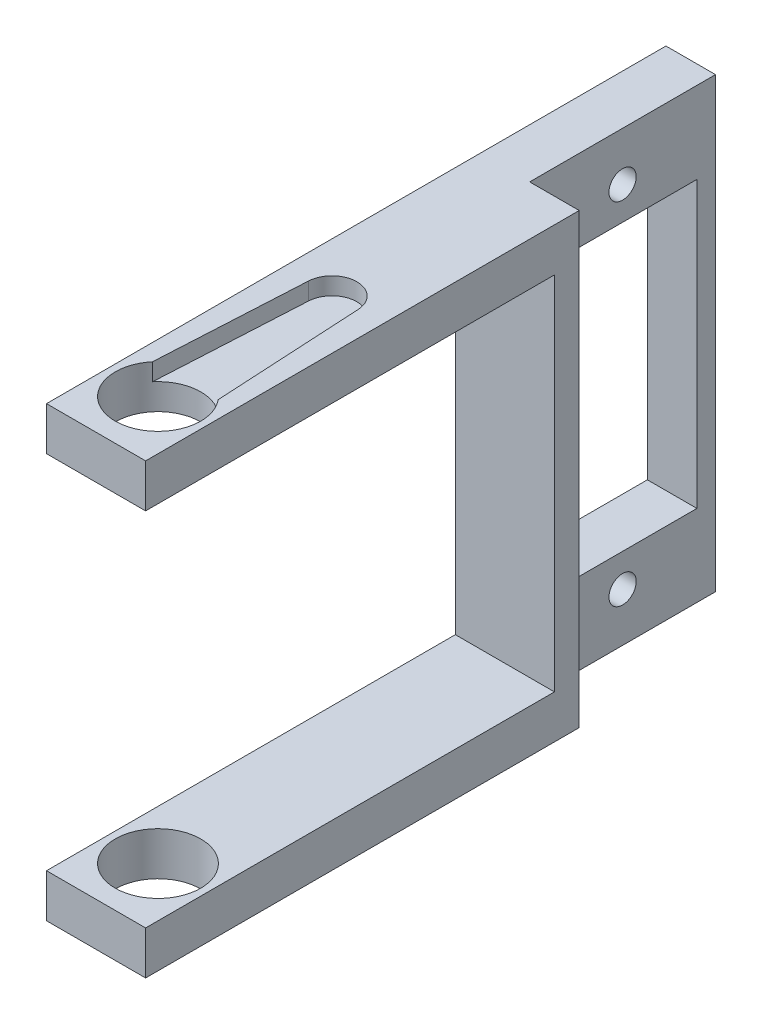
from build123d import *
from build123d.topology import SkipClean

# Parameters (mm, degrees)
SKETCH2_W             = 8
SKETCH2_H             = 3.5
BOSS_EXTRUDE2_DEPTH   = 35
BOSS_EXTRUDE2_2_DEPTH = 35
SKETCH2_3_W           = 8
SKETCH2_3_H           = 29.15
BOSS_EXTRUDE3_DEPTH   = 2
SKETCH7_W             = 4
SKETCH7_H             = 36.15
BOSS_EXTRUDE4_DEPTH   = 15
CUT_EXTRUDE5_REACH    = 51.739
SKETCH8_R             = 1.1
SKETCH8_W             = 12
SKETCH8_H             = 23
CUT_EXTRUDE6_DEPTH    = 1.4
SKETCH10_R            = 3.45
CUT_EXTRUDE7_DEPTH    = 52.060667156


with BuildPart() as part:
    # Sketch2 → Boss-Extrude2 (new body)
    with BuildSketch(Plane.XY):
        with Locations((-4.681545395, -0.713506952)):
            Rectangle(SKETCH2_W, SKETCH2_H)
    extrude(amount=BOSS_EXTRUDE2_DEPTH)

    # Sketch2<3> → Boss-Extrude3 (add)
    with BuildSketch(Plane.XY):
        with Locations((-4.681545395, -17.038506952)):
            Rectangle(SKETCH2_3_W, SKETCH2_3_H)
    extrude(amount=BOSS_EXTRUDE3_DEPTH)



with BuildPart() as body_2:
    # Sketch2 → Boss-Extrude2 2 (new body)
    with BuildSketch(Plane.XY):
        with Locations((-4.681545395, -33.363506952)):
            Rectangle(SKETCH2_W, SKETCH2_H)
    extrude(amount=BOSS_EXTRUDE2_2_DEPTH)


with BuildPart() as part_1:
    add(part.part)

    add(body_2.part)  # Boss-Extrude4 merges body 2
    # Sketch7 → Boss-Extrude4 (add)
    with BuildSketch(Plane(origin=(0, 0, 0), x_dir=(-1, 0, 0), z_dir=(0, 0, -1))):
        with Locations((6.681545395, -17.038506952)):
            Rectangle(SKETCH7_W, SKETCH7_H)
    extrude(amount=BOSS_EXTRUDE4_DEPTH)

    # Sketch8 → Cut-Extrude5 (cut, up to next)
    with BuildSketch(Plane(origin=(-4.681545395, 0, 0), x_dir=(0, 0, -1), z_dir=(1, 0, 0)), mode=Mode.PRIVATE) as cut_extrude5_sk1:
        with Locations((7.5, -2.888506952)):
            Circle(SKETCH8_R)
    cut_extrude5_tool1 = extrude(cut_extrude5_sk1.sketch, amount=-CUT_EXTRUDE5_REACH, mode=Mode.PRIVATE) & part_1.part
    # Sketch8 → Cut-Extrude5 (cut, up to next)
    with BuildSketch(Plane(origin=(-4.681545395, 0, 0), x_dir=(0, 0, -1), z_dir=(1, 0, 0)), mode=Mode.PRIVATE) as cut_extrude5_sk2:
        with Locations((7.5, -31.188506952)):
            Circle(SKETCH8_R)
    cut_extrude5_tool2 = extrude(cut_extrude5_sk2.sketch, amount=-CUT_EXTRUDE5_REACH, mode=Mode.PRIVATE) & part_1.part
    # Sketch8 → Cut-Extrude5 (cut, up to next)
    with BuildSketch(Plane(origin=(-4.681545395, 0, 0), x_dir=(0, 0, -1), z_dir=(1, 0, 0)), mode=Mode.PRIVATE) as cut_extrude5_sk3:
        with Locations((7.5, -17.038506952)):
            Rectangle(SKETCH8_W, SKETCH8_H)
    cut_extrude5_tool3 = extrude(cut_extrude5_sk3.sketch, amount=-CUT_EXTRUDE5_REACH, mode=Mode.PRIVATE) & part_1.part
    add(cut_extrude5_tool1.solids().sort_by_distance((-4.681545, -2.888507, -7.5))[0], mode=Mode.SUBTRACT)
    add(cut_extrude5_tool2.solids().sort_by_distance((-4.681545, -31.188507, -7.5))[0], mode=Mode.SUBTRACT)
    add(cut_extrude5_tool3.solids().sort_by_distance((-4.681545, -17.038507, -7.5))[0], mode=Mode.SUBTRACT)

    # Sketch9 → Cut-Extrude6 (cut)
    with BuildSketch(Plane(origin=(0, 1.036493048, 0), x_dir=(1, 0, 0), z_dir=(0, 1, 0))):
        with BuildLine():
            Line((-2.684524514, -15.840878033), (-2.031545395, -27.790927797))
            ThreePointArc((-2.031545395, -27.790927797), (-4.681545395, -33.45), (-7.331545395, -27.790927797))
            Line((-7.331545395, -27.790927797), (-6.678566275, -15.840878033))
            ThreePointArc((-6.678566275, -15.840878033), (-4.681545395, -13.95), (-2.684524514, -15.840878033))
        make_face()
    extrude(amount=-CUT_EXTRUDE6_DEPTH, mode=Mode.SUBTRACT)

    # Sketch10 → Cut-Extrude7 (cut, through all)
    with SkipClean():  # the faces are left unmerged after this step: merging them gives an invalid solid
        with BuildSketch(Plane(origin=(0, 1.036493048, 0), x_dir=(1, 0, 0), z_dir=(0, 1, 0))):
            with Locations((-4.681545395, -30)):
                Circle(SKETCH10_R)
        extrude(amount=-CUT_EXTRUDE7_DEPTH, mode=Mode.SUBTRACT)


solid = part_1.part
